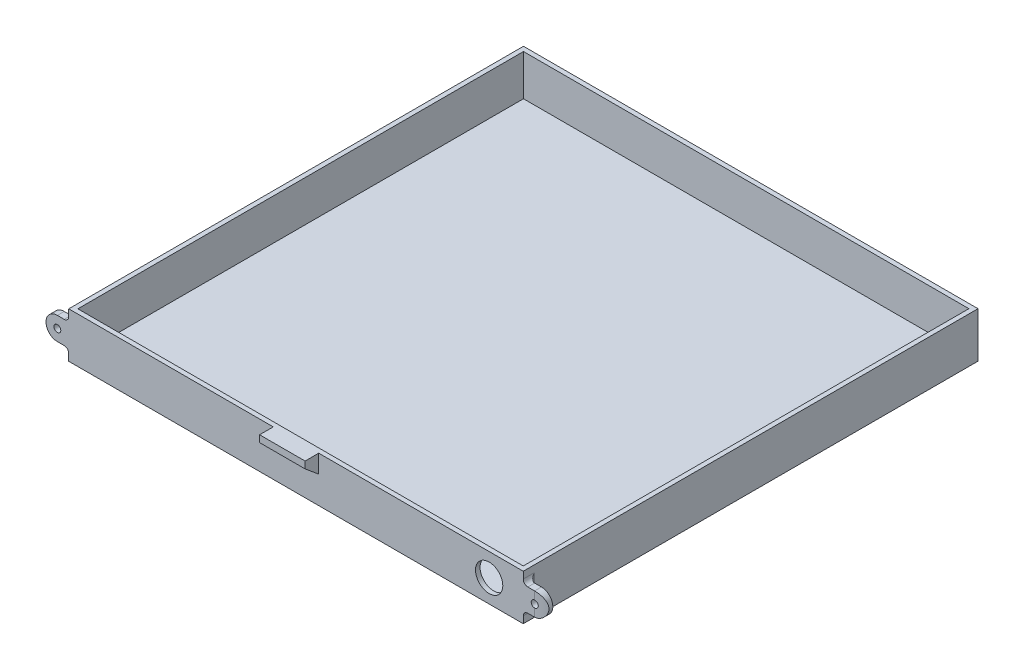
from build123d import *

# Parameters (mm, degrees)
SKETCH1_W           = 199.9
SKETCH1_H           = 200
BOSS_EXTRUDE1_DEPTH = 20
SHELL1_T            = -2
SKETCH2_R           = 6
CUT_EXTRUDE1_DEPTH  = 20
SKETCH3_W           = 20
SKETCH3_H           = 8
BOSS_EXTRUDE2_DEPTH = 3
RIB1_REACH          = 156.029
SKETCH5_WALL_W      = 317.868701922
SKETCH5_WALL_H      = 2
SKETCH6_R           = 1.5
BOSS_EXTRUDE3_DEPTH = 3
CUT_EXTRUDE2_DEPTH  = 154.460100678
FILLET1_R           = 2


with BuildPart() as part:
    # Sketch1 → Boss-Extrude1 (new body)
    with BuildSketch(Plane(origin=(0, 0, 0), x_dir=(1, 0, 0), z_dir=(0, 1, 0))):
        Rectangle(SKETCH1_W, SKETCH1_H)
    extrude(amount=BOSS_EXTRUDE1_DEPTH)

    # Shell1
    shell1_openings = [part.faces().sort_by_distance(p)[0] for p in [
        (0, 20, 0),
    ]]
    offset(amount=SHELL1_T, openings=shell1_openings, kind=Kind.INTERSECTION)

    # Sketch2 → Cut-Extrude1 (cut)
    with BuildSketch(Plane.XY.offset(100)):
        with Locations((84.95, 10)):
            Circle(SKETCH2_R)
    extrude(amount=-CUT_EXTRUDE1_DEPTH, mode=Mode.SUBTRACT)

    # Sketch3 → Boss-Extrude2 (add)
    with BuildSketch(Plane(origin=(0, 20, 0), x_dir=(1, 0, 0), z_dir=(0, 1, 0))):
        with Locations((0, -102)):
            Rectangle(SKETCH3_W, SKETCH3_H)
    extrude(amount=-BOSS_EXTRUDE2_DEPTH)

    # Sketch5 wall → Rib1 (add, up to next)
    with BuildSketch(Plane(origin=(-10, 14.5, 103), x_dir=(0, -0.640184399664, -0.768221279597), z_dir=(0, -0.768221279597, 0.640184399664)), mode=Mode.PRIVATE) as rib1_sk1:
        with Locations((0, 1)):
            Rectangle(SKETCH5_WALL_W, SKETCH5_WALL_H)
    rib1_tool1 = extrude(rib1_sk1.sketch, amount=-RIB1_REACH, mode=Mode.PRIVATE) - part.part
    rib1 = rib1_tool1.solids().sort_by_distance((-10, 14.5, 103))[0]
    add(rib1)

    # Mirror1: Rib1 across plane
    add(rib1.mirror(Plane(origin=(0, 0, 0), x_dir=(0, 0, 1), z_dir=(1, 0, 0))))

    # Sketch6 → Boss-Extrude3 (add)
    # profile 1 of 2: a face of its own
    with BuildSketch(Plane.XY.offset(100)):
        with BuildLine():
            Line((-104.95, 15), (-99.95, 15))
            Line((-99.95, 15), (-99.95, 5))
            Line((-99.95, 5), (-104.95, 5))
            ThreePointArc((-104.95, 5), (-109.95, 10), (-104.95, 15))
        make_face()
        with Locations((-104.95, 10)):
            Circle(SKETCH6_R, mode=Mode.SUBTRACT)
    # profile 2 of 2: a face of its own
    with BuildSketch(Plane.XY.offset(100)):
        with BuildLine():
            Line((104.95, 15), (99.95, 15))
            Line((99.95, 15), (99.95, 5))
            Line((99.95, 5), (104.95, 5))
            ThreePointArc((104.95, 5), (109.95, 10), (104.95, 15))
        make_face()
        with Locations(Location((104.95, 10, 0), (0, 0, 180))):
            Circle(SKETCH6_R, mode=Mode.SUBTRACT)
    extrude(amount=-BOSS_EXTRUDE3_DEPTH)

    # Sketch7 → Cut-Extrude2 (cut, through all)
    with BuildSketch(Plane(origin=(0, 15, 0), x_dir=(1, 0, 0), z_dir=(0, 1, 0))):
        with BuildLine():
            Line((105, -100), (109.95, -100))
            Line((109.95, -100), (109.95, -98.688929738))
            ThreePointArc((109.95, -98.688929738), (107.560342029, -99.666677231), (105, -100))
        make_face()
    extrude(amount=-CUT_EXTRUDE2_DEPTH, mode=Mode.SUBTRACT)

    # Fillet1
    fillet1_edges = [part.edges().sort_by_distance(p)[0] for p in [
        (-99.95, 10, 97),
        (-99.95, 15, 98.5),
        (-99.95, 5, 98.5),
        (99.95, 10, 97),
        (99.95, 5, 98.5),
        (99.95, 15, 98.5),
    ]]
    fillet(fillet1_edges, radius=FILLET1_R)


solid = part.part
